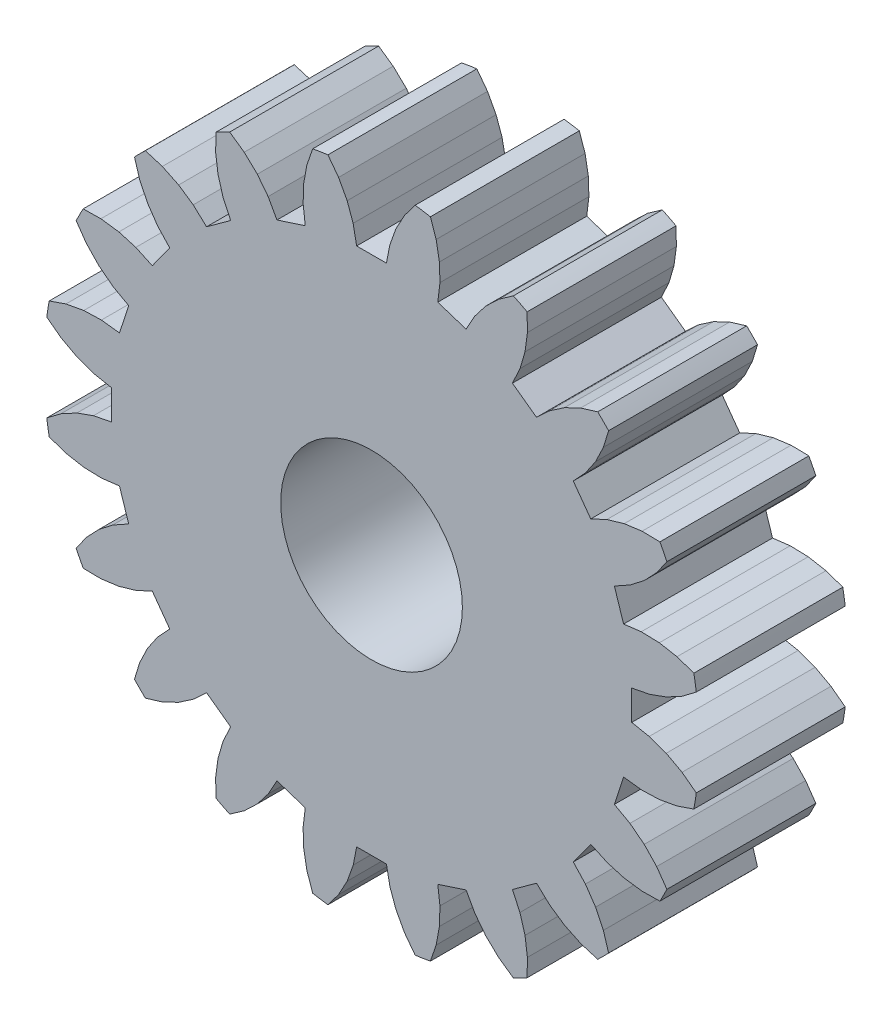
from build123d import *

# Parameters (mm, degrees)
CROQUIS1_R              = 11
CROQUIS1_R_2            = 3.05
SALIENTE_EXTRUIR1_DEPTH = 5
CORTAR_EXTRUIR6_DEPTH   = 5


with BuildPart() as part:
    # Croquis1 → Saliente-Extruir1 (new body)
    with BuildSketch(Plane.XY):
        with Locations((-0.441783127, 0.370500553)):
            Circle(CROQUIS1_R)
        with Locations((-0.441783127, 0.370500553)):
            Circle(CROQUIS1_R_2, mode=Mode.SUBTRACT)
    extrude(amount=SALIENTE_EXTRUIR1_DEPTH)

    # Croquis6 → Cortar-Extruir6 (cut)
    with BuildSketch(Plane.XY.offset(5)):
        Polygon((6.330893957, 5.90907854), (6.918589875, 5.100184504), (7.460121205, 5.352322775), (8.041494908, 5.522784033), (8.640330703, 5.603393111), (9.239211014, 5.593368772), (8.939770859, 6.614636798), (8.340912806, 7.438894195), (7.517051439, 7.963718076), (7.34289312, 7.394569364), (7.079806731, 6.846434253), (6.746578092, 6.356898501), align=None)
        Polygon((8.244653353, 3.842577552), (7.710930269, 3.545128922), (8.019900298, 2.594216952), (8.612842208, 2.666672314), (9.218436883, 2.64913625), (9.812873143, 2.540749601), (10.379344475, 2.346151695), (10.410149139, 3.409967402), (10.095310829, 4.378940086), (9.473951606, 5.132664422), (9.132440577, 4.645189711), (8.712847488, 4.205180406), align=None)
        Polygon((8.892439689, 0.988385516), (8.292922191, 0.870424561), (8.292922191, -0.129423454), (8.879233397, -0.243743438), (9.449769217, -0.447560272), (9.981618378, -0.734333007), (10.46023057, -1.094455882), (10.818264679, -0.092226186), (10.818264679, 0.926611988), (10.46023057, 1.835456988), (9.984796311, 1.477373699), (9.449769217, 1.188561378), align=None)
        Polygon((8.626527261, -1.926289406), (8.019900298, -1.853215846), (7.710930269, -2.804127816), (8.233218545, -3.094032708), (8.712847488, -3.4641793), (9.130048451, -3.901266808), (9.473951606, -4.391663316), (10.124168287, -3.549124857), (10.439006597, -2.580152173), (10.379344475, -1.605150588), (9.816525803, -1.798790768), (9.218436883, -1.908135144), align=None)
        Polygon((7.472945429, -4.616138525), (6.918589875, -4.359183398), (6.330893957, -5.168077434), (6.738034087, -5.605189323), (7.079806731, -6.105433147), (7.341520957, -6.650050256), (7.517051439, -7.22271697), (8.395802953, -6.622343283), (8.994661006, -5.798085886), (9.239211014, -4.852367666), (8.644100543, -4.862609886), (8.041494908, -4.781782927), align=None)
        Polygon((5.544614821, -6.817860666), (5.09679486, -6.402176531), (4.287900824, -6.989872449), (4.540039095, -7.531403779), (4.710500353, -8.112777482), (4.791109431, -8.711613277), (4.781085092, -9.310493588), (5.802353118, -9.011053432), (6.626610515, -8.412195379), (7.151434396, -7.588334013), (6.582285684, -7.414175694), (6.034150573, -7.151089305), align=None)
        Polygon((3.030293872, -8.315935927), (2.732845242, -7.782212843), (1.781933272, -8.091182871), (1.854388634, -8.684124782), (1.83685257, -9.289719457), (1.728465921, -9.884155716), (1.533868015, -10.450627048), (2.597683722, -10.481431713), (3.566656407, -10.166593402), (4.320380742, -9.545234179), (3.832906031, -9.203723151), (3.392896726, -8.784130062), align=None)
        Polygon((0.176101836, -8.963722263), (0.058140881, -8.364204765), (-0.941707134, -8.364204765), (-1.056027117, -8.950515971), (-1.259843952, -9.521051791), (-1.546616687, -10.052900952), (-1.906739562, -10.531513144), (-0.904509866, -10.889547253), (0.114328308, -10.889547253), (1.023173308, -10.531513144), (0.665090019, -10.056078884), (0.376277698, -9.521051791), align=None)
        Polygon((-2.738573086, -8.697809835), (-2.665499526, -8.091182871), (-3.616411496, -7.782212843), (-3.906316387, -8.304501119), (-4.27646298, -8.784130062), (-4.713550488, -9.201331025), (-5.203946996, -9.545234179), (-4.361408537, -10.195450861), (-3.392435853, -10.510289171), (-2.417434268, -10.450627048), (-2.611074448, -9.887808376), (-2.720418824, -9.289719457), align=None)
        Polygon((-5.428422205, -7.544228003), (-5.171467078, -6.989872449), (-5.980361114, -6.402176531), (-6.417473003, -6.809316661), (-6.917716827, -7.151089305), (-7.462333936, -7.412803531), (-8.03500065, -7.588334013), (-7.434626963, -8.467085526), (-6.610369566, -9.065943579), (-5.664651346, -9.310493588), (-5.674893566, -8.715383117), (-5.594066607, -8.112777482), align=None)
        Polygon((-7.630144346, -5.615897395), (-7.214460211, -5.168077434), (-7.802156129, -4.359183398), (-8.343687459, -4.611321669), (-8.925061162, -4.781782927), (-9.523896957, -4.862392005), (-10.122777268, -4.852367666), (-9.823337112, -5.873635692), (-9.224479059, -6.697893089), (-8.400617693, -7.22271697), (-8.226459373, -6.653568258), (-7.963372985, -6.105433147), align=None)
        Polygon((-9.128219607, -3.101576446), (-8.594496523, -2.804127816), (-8.903466551, -1.853215846), (-9.496408462, -1.925671208), (-10.102003137, -1.908135144), (-10.696439396, -1.799748495), (-11.262910728, -1.605150588), (-11.293715393, -2.668966296), (-10.978877082, -3.63793898), (-10.357517859, -4.391663316), (-10.016006831, -3.904188605), (-9.596413742, -3.4641793), align=None)
        Polygon((-9.776005943, -0.247384409), (-9.176488445, -0.129423454), (-9.176488445, 0.870424561), (-9.762799651, 0.984744544), (-10.333335471, 1.188561378), (-10.865184632, 1.475334113), (-11.343796824, 1.835456988), (-11.701830933, 0.833227292), (-11.701830933, -0.185610882), (-11.343796824, -1.094455882), (-10.868362564, -0.736372593), (-10.333335471, -0.447560272), align=None)
        Polygon((-9.510093515, 2.667290513), (-8.903466551, 2.594216952), (-8.594496523, 3.545128922), (-9.116784799, 3.835033814), (-9.596413742, 4.205180406), (-10.013614705, 4.642267914), (-10.357517859, 5.132664422), (-11.00773454, 4.290125963), (-11.322572851, 3.321153279), (-11.262910728, 2.346151695), (-10.700092056, 2.539791874), (-10.102003137, 2.64913625), align=None)
        Polygon((-8.356511683, 5.357139631), (-7.802156129, 5.100184504), (-7.214460211, 5.90907854), (-7.621600341, 6.346190429), (-7.963372985, 6.846434253), (-8.225087211, 7.391051362), (-8.400617693, 7.963718076), (-9.279369206, 7.363344389), (-9.878227259, 6.539086992), (-10.122777268, 5.593368772), (-9.527666797, 5.603610992), (-8.925061162, 5.522784033), align=None)
        Polygon((-6.428181075, 7.558861772), (-5.980361114, 7.143177637), (-5.171467078, 7.730873555), (-5.423605349, 8.272404885), (-5.594066607, 8.853778588), (-5.674675685, 9.452614383), (-5.664651346, 10.051494694), (-6.685919372, 9.752054539), (-7.510176769, 9.153196486), (-8.03500065, 8.329335119), (-7.465851938, 8.1551768), (-6.917716827, 7.892090411), align=None)
        Polygon((-3.913860126, 9.056937033), (-3.616411496, 8.523213949), (-2.665499526, 8.832183978), (-2.737954888, 9.425125888), (-2.720418824, 10.030720563), (-2.612032175, 10.625156823), (-2.417434268, 11.191628155), (-3.481249976, 11.222432819), (-4.45022266, 10.907594509), (-5.203946996, 10.286235286), (-4.716472285, 9.944724257), (-4.27646298, 9.525131168), align=None)
        Polygon((-1.059668089, 9.704723369), (-0.941707134, 9.105205871), (0.058140881, 9.105205871), (0.172460864, 9.691517077), (0.376277698, 10.262052897), (0.663050433, 10.793902058), (1.023173308, 11.27251425), (0.020943612, 11.630548359), (-0.997894562, 11.630548359), (-1.906739562, 11.27251425), (-1.548656273, 10.797079991), (-1.259843952, 10.262052897), align=None)
        Polygon((1.855006833, 9.438810941), (1.781933272, 8.832183978), (2.732845242, 8.523213949), (3.022750134, 9.045502225), (3.392896726, 9.525131168), (3.829984234, 9.942332131), (4.320380742, 10.286235286), (3.477842283, 10.936451967), (2.508869599, 11.251290277), (1.533868015, 11.191628155), (1.727508194, 10.628809483), (1.83685257, 10.030720563), align=None)
        Polygon((4.544855951, 8.285229109), (4.287900824, 7.730873555), (5.09679486, 7.143177637), (5.533906749, 7.550317767), (6.034150573, 7.892090411), (6.578767682, 8.153804637), (7.151434396, 8.329335119), (6.551060709, 9.208086633), (5.726803312, 9.806944686), (4.781085092, 10.051494694), (4.791327312, 9.456384223), (4.710500353, 8.853778588), align=None)
    extrude(amount=-CORTAR_EXTRUIR6_DEPTH, mode=Mode.SUBTRACT)


solid = part.part
